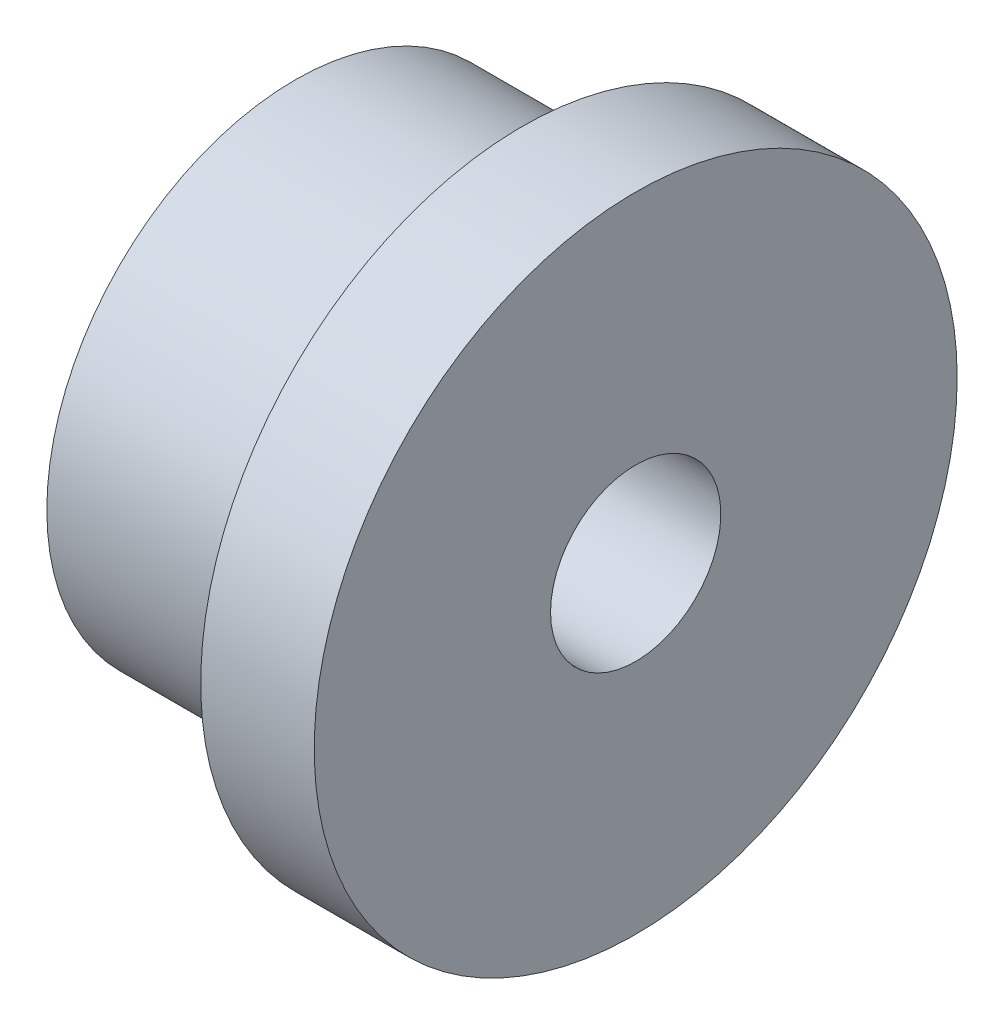
from build123d import *

# Parameters (mm, degrees)
SKETCH1_R                   = 8.9916
BOSS_EXTRUDE1_DEPTH         = 3.175
SKETCH2_R                   = 6.9453125
BOSS_EXTRUDE2_DEPTH         = 6.35
F_21_0_159_DIAMETER_HOLE1_D = 4.7625


with BuildPart() as part:
    # Sketch1 → Boss-Extrude1 (new body)
    with BuildSketch(Plane(origin=(0, 0, 0), x_dir=(0, 0, -1), z_dir=(1, 0, 0))):
        Circle(SKETCH1_R)
    extrude(amount=BOSS_EXTRUDE1_DEPTH)

    # Sketch2 → Boss-Extrude2 (add)
    with BuildSketch(Plane.ZY):
        with Locations(Location((0, 0, 0), (0, 0, 180))):
            Circle(SKETCH2_R)
    extrude(amount=BOSS_EXTRUDE2_DEPTH)

    # #21 (0.159) Diameter Hole1 (through all)
    with Locations(Plane.ZY.offset(6.35)):
        with Locations((0, 0)):
            Hole(F_21_0_159_DIAMETER_HOLE1_D / 2)


solid = part.part
